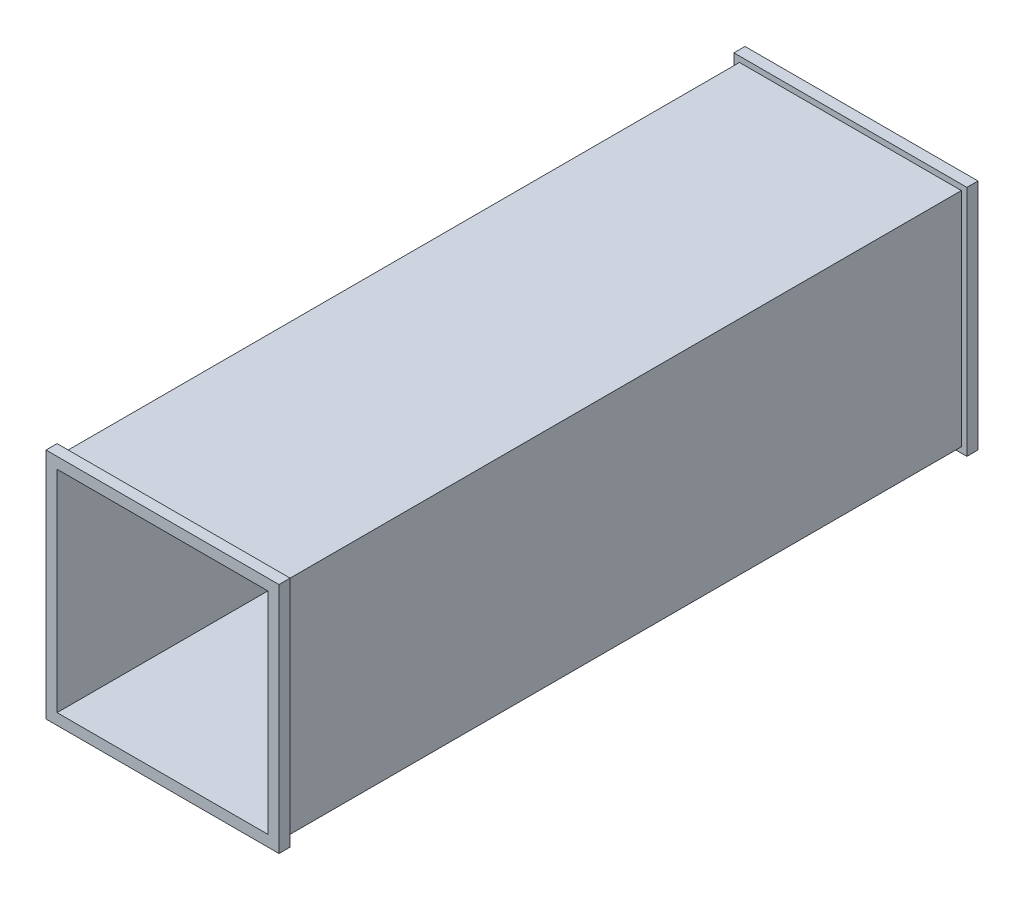
from build123d import *

# Parameters (mm, degrees)
SKETCH5_W           = 533.4
SKETCH5_H           = 533.4
SKETCH5_W_2         = 482.6
SKETCH5_H_2         = 482.6
BOSS_EXTRUDE1_DEPTH = 25.4
SKETCH6_W           = 533.4
SKETCH6_H           = 533.4
SKETCH6_W_2         = 482.6
SKETCH6_H_2         = 482.6
BOSS_EXTRUDE2_DEPTH = 25.4


with BuildPart() as part:
    # Sketch2 → Loft1 section 0
    with BuildSketch(Plane.XY.offset(1549.4)):
        with BuildLine():
            Line((-254, -254), (254, -254))
            Line((254, -254), (254, 254))
            Line((254, 254), (-254, 254))
            Line((-254, 254), (-254, -254))
        make_face()
    # Sketch1 → Loft1 section 1
    with BuildSketch(Plane.XY):
        with BuildLine():
            Line((-254, -254), (254, -254))
            Line((254, -254), (254, 254))
            Line((254, 254), (-254, 254))
            Line((-254, 254), (-254, -254))
        make_face()
    loft()

    # Sketch4 → Cut-Loft1 section 0
    with BuildSketch(Plane(origin=(0, 0, 0), x_dir=(-1, 0, 0), z_dir=(0, 0, -1))):
        with BuildLine():
            Line((-241.3, -241.3), (241.3, -241.3))
            Line((241.3, -241.3), (241.3, 241.3))
            Line((241.3, 241.3), (-241.3, 241.3))
            Line((-241.3, 241.3), (-241.3, -241.3))
        make_face()
    # Sketch3 → Cut-Loft1 section 1
    with BuildSketch(Plane.XY.offset(1549.4)):
        with BuildLine():
            Line((241.3, -241.3), (241.3, 241.3))
            Line((241.3, 241.3), (-241.3, 241.3))
            Line((-241.3, 241.3), (-241.3, -241.3))
            Line((-241.3, -241.3), (241.3, -241.3))
        make_face()
    loft(mode=Mode.SUBTRACT)

    # Sketch5 → Boss-Extrude1 (add)
    with BuildSketch(Plane(origin=(0, 0, 0), x_dir=(-1, 0, 0), z_dir=(0, 0, -1))):
        Rectangle(SKETCH5_W, SKETCH5_H)
        Rectangle(SKETCH5_W_2, SKETCH5_H_2, mode=Mode.SUBTRACT)
    extrude(amount=BOSS_EXTRUDE1_DEPTH)

    # Sketch6 → Boss-Extrude2 (add)
    with BuildSketch(Plane.XY.offset(1549.4)):
        Rectangle(SKETCH6_W, SKETCH6_H)
        Rectangle(SKETCH6_W_2, SKETCH6_H_2, mode=Mode.SUBTRACT)
    extrude(amount=BOSS_EXTRUDE2_DEPTH)


solid = part.part
